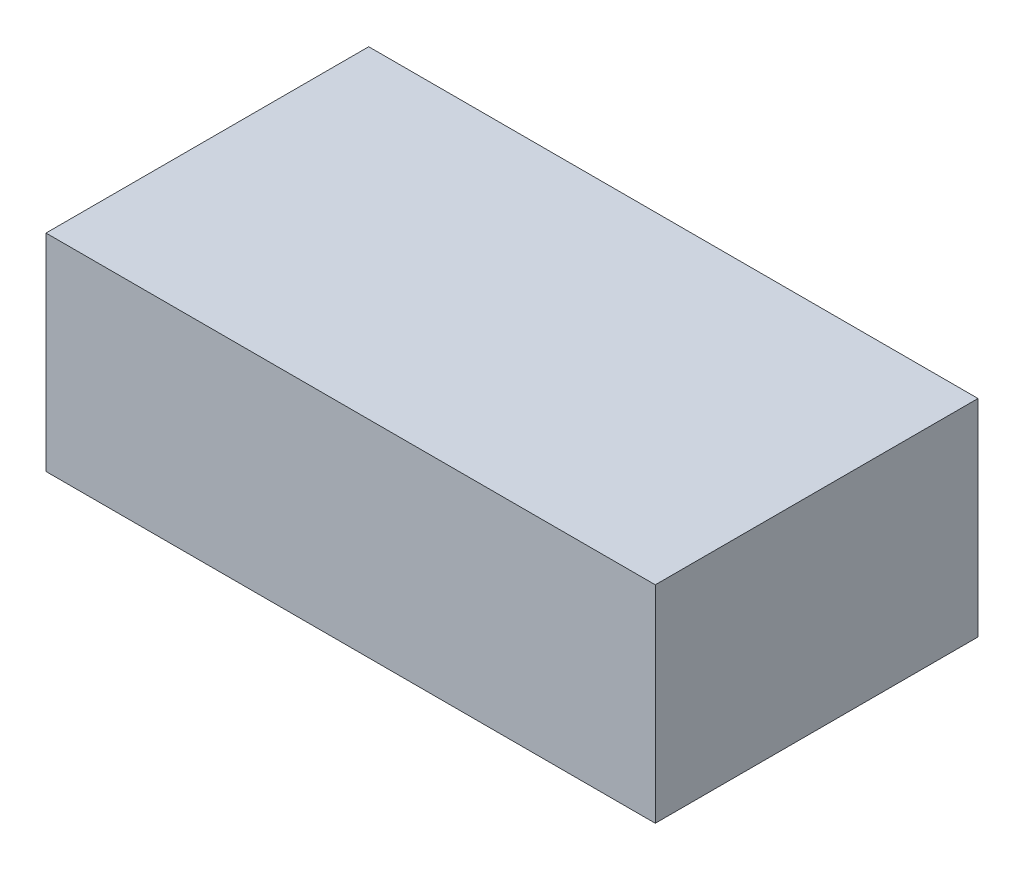
from build123d import *

# Parameters (mm, degrees)
SKETCH1_W           = 2.9972
SKETCH1_H           = 1.5875
BOSS_EXTRUDE1_DEPTH = 1.016


with BuildPart() as part:
    # Sketch1 → Boss-Extrude1 (new body)
    with BuildSketch(Plane(origin=(0, 0, 0), x_dir=(1, 0, 0), z_dir=(0, 1, 0))):
        Rectangle(SKETCH1_W, SKETCH1_H)
    extrude(amount=BOSS_EXTRUDE1_DEPTH)


solid = part.part
